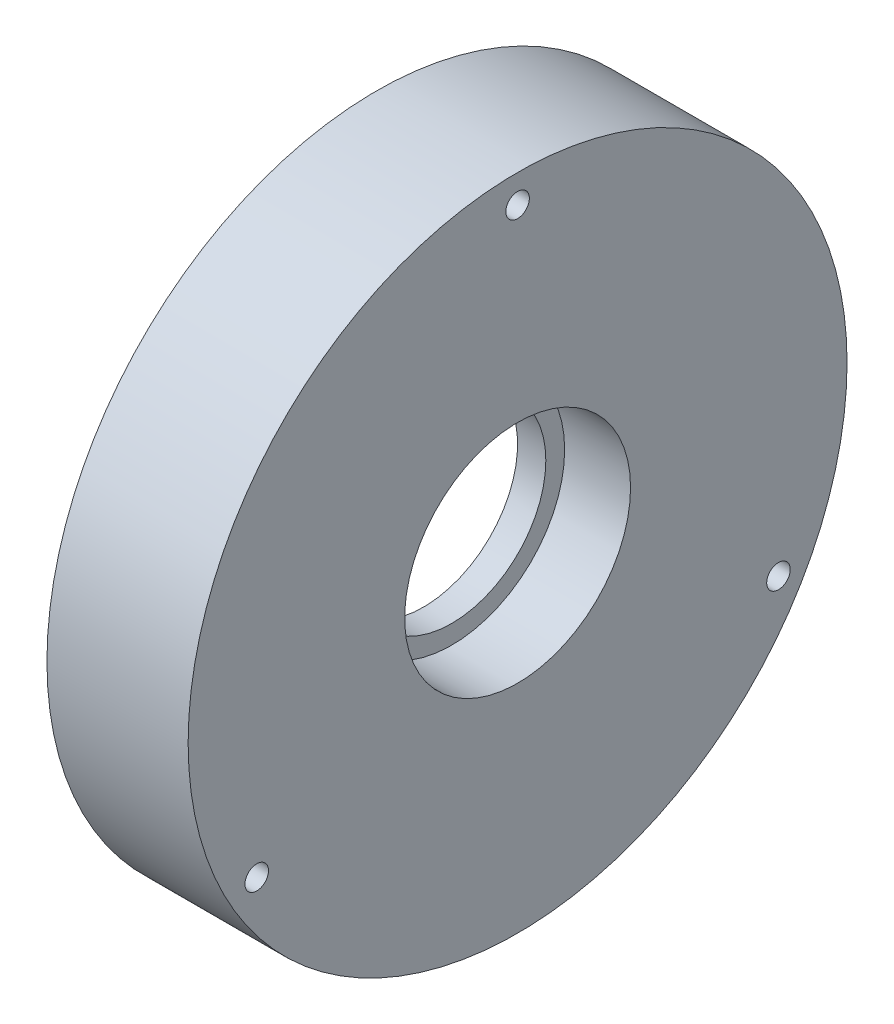
from build123d import *

# Parameters (mm, degrees)
BASPROSKE_W         = 5
BASPROSKE_H         = 4.25
TOOTHCUT_DEPTH      = 26.248762346
TEETHCUTS_COUNT     = 55
TEETHCUTS_ANGLE     = 353.454545455
BOSS_EXTRUDE1_START = 2.5
SKETCH1_R           = 17.5
SKETCH1_R_2         = 5
BOSS_EXTRUDE1_DEPTH = 2.5
SKETCH2_R           = 7.75
SKETCH2_R_2         = 5
BOSS_EXTRUDE2_DEPTH = 2.5
SKETCH3_R           = 6
CUT_EXTRUDE1_DEPTH  = 3.5
M1_6_TAPPED_HOLE1_D = 1.25
CIRPATTERN1_COUNT   = 3


with BuildPart() as part:
    # BasProSke → Base-Revolve (revolve)
    with BuildSketch(Plane(origin=(0, 0, 0), x_dir=(1, 0, 0), z_dir=(0, 1, 0)), mode=Mode.PRIVATE) as base_revolve_sk:
        with Locations((2.5, 15.375)):
            Rectangle(BASPROSKE_W, BASPROSKE_H)
    revolve(base_revolve_sk.sketch.rotate(Axis((-10, 0, 0), (1, 0, 0)), 180), axis=Axis((-10, 0, 0), (1, 0, 0)))

    # TooCutSke → ToothCut (cut, through all)
    with BuildSketch(Plane(origin=(0, 0, 0), x_dir=(0, 0, -1), z_dir=(1, 0, 0))):
        with BuildLine():
            ThreePointArc((0.61765291, 13.210168434), (0.417066145, 13.802967889), (0.163405078, 14.375071297))
            ThreePointArc((0.163405078, 14.375071297), (0, 14.376), (-0.163405078, 14.375071297))
            ThreePointArc((-0.163405078, 14.375071297), (-0.417066145, 13.802967889), (-0.61765291, 13.210168434))
            ThreePointArc((-0.61765291, 13.210168434), (0, 13.2246), (0.61765291, 13.210168434))
        make_face()
    toothcut = extrude(amount=TOOTHCUT_DEPTH, mode=Mode.SUBTRACT)

    # TeethCuts: ToothCut ×55 about axis
    teethcuts_axis = Axis((-10, 0, 0), (1, 0, 0))
    for i in range(1, TEETHCUTS_COUNT):
        add(toothcut.rotate(teethcuts_axis, i * TEETHCUTS_ANGLE / (TEETHCUTS_COUNT - 1)), mode=Mode.SUBTRACT)

    # Sketch1 → Boss-Extrude1 (add)
    with BuildSketch(Plane(origin=(5, 0, 0), x_dir=(0, 0, -1), z_dir=(1, 0, 0)).offset(BOSS_EXTRUDE1_START)):
        with Locations(Location((0, 0, 0), (0, 0, 180))):
            Circle(SKETCH1_R)
        Circle(SKETCH1_R_2, mode=Mode.SUBTRACT)
    extrude(amount=-BOSS_EXTRUDE1_DEPTH)

    # Sketch2 → Boss-Extrude2 (add)
    with BuildSketch(Plane.ZY.offset(-5)):
        with Locations(Location((0, 0, 0), (0, 0, 180))):
            Circle(SKETCH2_R)
        Circle(SKETCH2_R_2, mode=Mode.SUBTRACT)
    extrude(amount=BOSS_EXTRUDE2_DEPTH)

    # Sketch3 → Cut-Extrude1 (cut)
    with BuildSketch(Plane(origin=(7.5, 0, 0), x_dir=(0, 0, -1), z_dir=(1, 0, 0))):
        Circle(SKETCH3_R)
    extrude(amount=-CUT_EXTRUDE1_DEPTH, mode=Mode.SUBTRACT)

    # M1.6 Tapped Hole1 (through all)
    with Locations(Plane(origin=(7.5, 0, 0), x_dir=(0, 0, -1), z_dir=(1, 0, 0))):
        with Locations((0, 16)):
            m1_6_tapped_hole1 = Hole(M1_6_TAPPED_HOLE1_D / 2)

    # CirPattern1: M1.6 Tapped Hole1 ×3 about axis
    cirpattern1_axis = Axis((0, 0, 0), (1, 0, 0))
    for i in range(1, CIRPATTERN1_COUNT):
        add(m1_6_tapped_hole1.rotate(cirpattern1_axis, i * 360 / CIRPATTERN1_COUNT), mode=Mode.SUBTRACT)


solid = part.part
